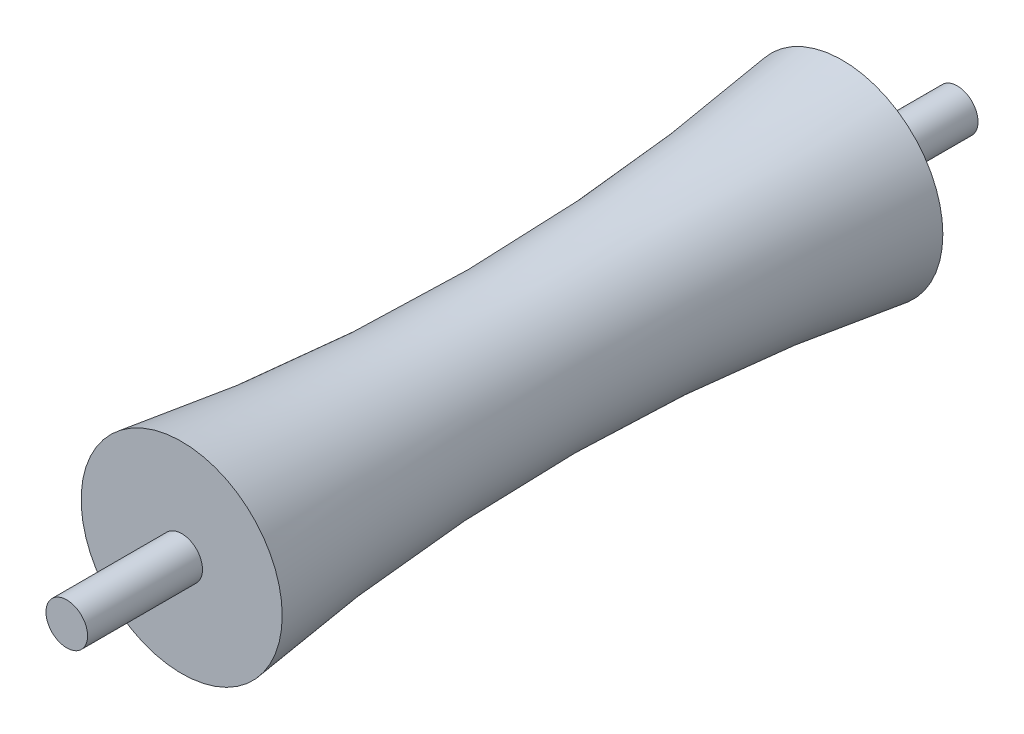
from build123d import *

# Parameters (mm, degrees)
SKETCH2_R           = 1.45
BOSS_EXTRUDE1_DEPTH = 8
BOSS_EXTRUDE2_START = 8
SKETCH3_R           = 1.45
BOSS_EXTRUDE2_DEPTH = 8


with BuildPart() as part:
    # Sketch1 → Revolve1 (revolve)
    with BuildSketch(Plane(origin=(0, 0, 0), x_dir=(1, 0, 0), z_dir=(0, 1, 0))):
        with BuildLine():
            Line((0, 0), (0, 46))
            Line((0, 46), (7, 46))
            ThreePointArc((7, 46), (5.226178525, 23), (7, 0))
            Line((7, 0), (0, 0))
        make_face()
    revolve(axis=Axis((0, 0, 0), (0, 0, -1)))

    # Sketch2 → Boss-Extrude1 (add)
    with BuildSketch(Plane.XY):
        Circle(SKETCH2_R)
    extrude(amount=BOSS_EXTRUDE1_DEPTH)

    # Sketch3 → Boss-Extrude2 (add)
    with BuildSketch(Plane(origin=(0, 0, -46), x_dir=(-1, 0, 0), z_dir=(0, 0, -1)).offset(BOSS_EXTRUDE2_START)):
        with Locations(Location((0, 0, 0), (0, 0, 180))):
            Circle(SKETCH3_R)
    extrude(amount=-BOSS_EXTRUDE2_DEPTH)


solid = part.part
